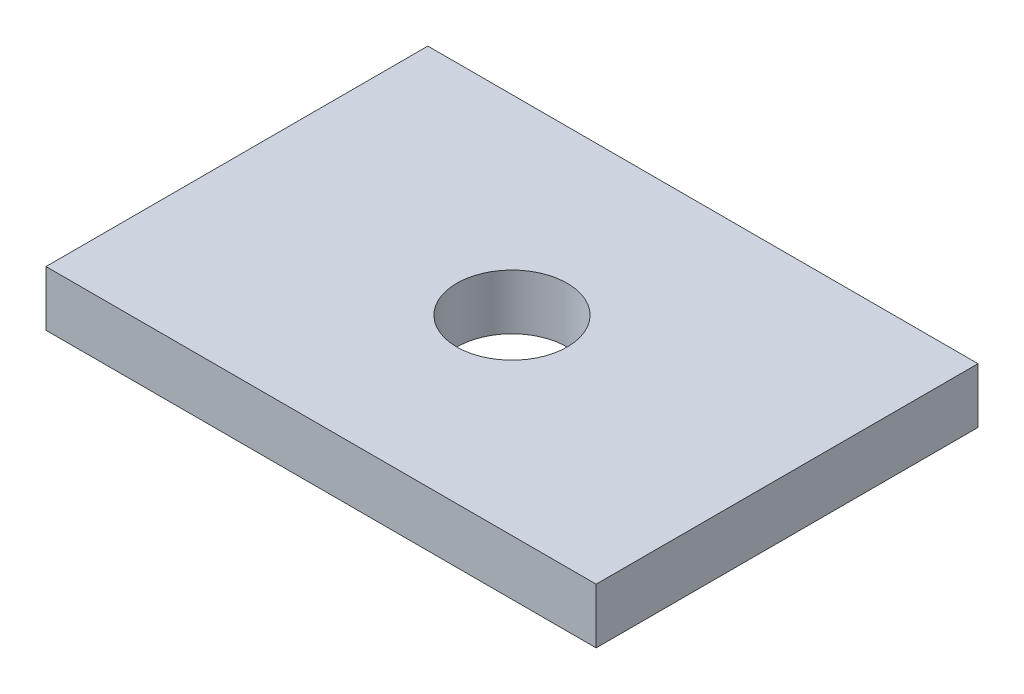
from build123d import *

# Parameters (mm, degrees)
SKETCH1_W              = 126.491795746
SKETCH1_H              = 87.800187636
BOSS_EXTRUDE1_DEPTH    = 12.7
F_1_1_DIAMETER_HOLE1_D = 25.4


with BuildPart() as part:
    # Sketch1 → Boss-Extrude1 (new body)
    with BuildSketch(Plane(origin=(0, 0, 0), x_dir=(1, 0, 0), z_dir=(0, 1, 0))):
        Rectangle(SKETCH1_W, SKETCH1_H)
    extrude(amount=BOSS_EXTRUDE1_DEPTH)

    # 1 (1) Diameter Hole1 (through all)
    with Locations(Plane(origin=(0, 12.7, 0), x_dir=(1, 0, 0), z_dir=(0, 1, 0))):
        with Locations((0, 0)):
            Hole(F_1_1_DIAMETER_HOLE1_D / 2)


solid = part.part
